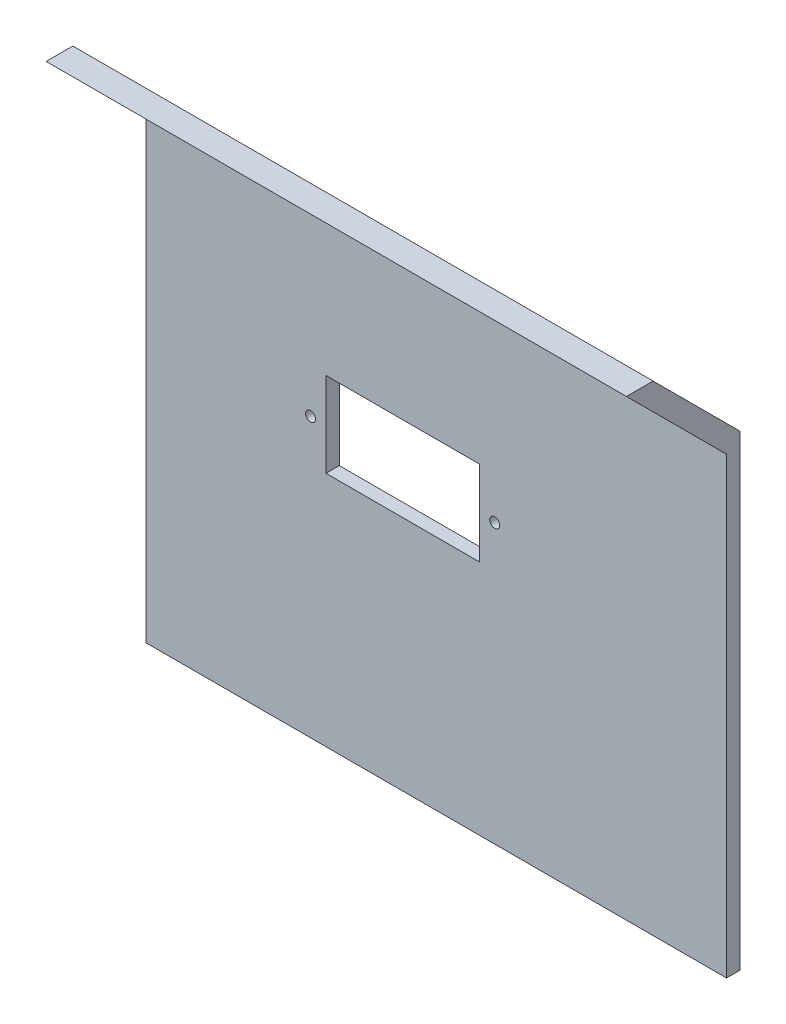
from build123d import *

# Parameters (mm, degrees)
SKETCH_1_W          = 87
SKETCH_1_H          = 70
EXTRUDE_1_DEPTH     = 2
EXTRUDE_2_DEPTH     = 87
SKETCH_6_W          = 23
SKETCH_6_H          = 12.7
CUT_EXTRUDE_1_DEPTH = 15
SKETCH_7_R          = 0.75
CUT_EXTRUDE_2_DEPTH = 15
CUT_EXTRUDE_3_DEPTH = 5


with BuildPart() as part:
    # 草图1 → 凸台-拉伸1 (new body)
    with BuildSketch(Plane.XY):
        with Locations((-41.5, -157.880838162)):
            Rectangle(SKETCH_1_W, SKETCH_1_H)
    extrude(amount=EXTRUDE_1_DEPTH)

    # 草图3 → 凸台-拉伸2 (add)
    with BuildSketch(Plane(origin=(2, 0, 0), x_dir=(0, 0, -1), z_dir=(1, 0, 0))):
        Polygon((-17, -109.880838162), (-2, -124.880838162), (0, -122.880838162), (-13, -109.880838162), align=None)
    extrude(amount=-EXTRUDE_2_DEPTH)

    # 草图6 → 切除-拉伸1 (cut)
    with BuildSketch(Plane.XY.offset(2)):
        with Locations((-46.550124355, -151.030838162)):
            Rectangle(SKETCH_6_W, SKETCH_6_H)
    extrude(amount=-CUT_EXTRUDE_1_DEPTH, mode=Mode.SUBTRACT)

    # 草图7 → 切除-拉伸2 (cut)
    with BuildSketch(Plane.XY.offset(2)):
        with Locations((-32.750124355, -151.130838162)):
            Circle(SKETCH_7_R)
        with Locations((-60.350124355, -151.130838162)):
            Circle(SKETCH_7_R)
    extrude(amount=-CUT_EXTRUDE_2_DEPTH, mode=Mode.SUBTRACT)

    # 草图8 → 切除-拉伸3 (cut)
    with BuildSketch(Plane(origin=(0, -63.440419081, 63.440419081), x_dir=(1, 0, 0), z_dir=(0, -0.707106781186556, 0.7071067811865391))):
        with BuildLine():
            Line((-51.5, -75.764432966), (-31.5, -75.764432966))
            ThreePointArc((-31.5, -75.764432966), (-27.5, -79.764432966), (-31.5, -83.764432966))
            Line((-31.5, -83.764432966), (-51.5, -83.764432966))
            ThreePointArc((-51.5, -83.764432966), (-55.5, -79.764432966), (-51.5, -75.764432966))
        make_face()
    extrude(amount=-CUT_EXTRUDE_3_DEPTH, mode=Mode.SUBTRACT)


solid = part.part
